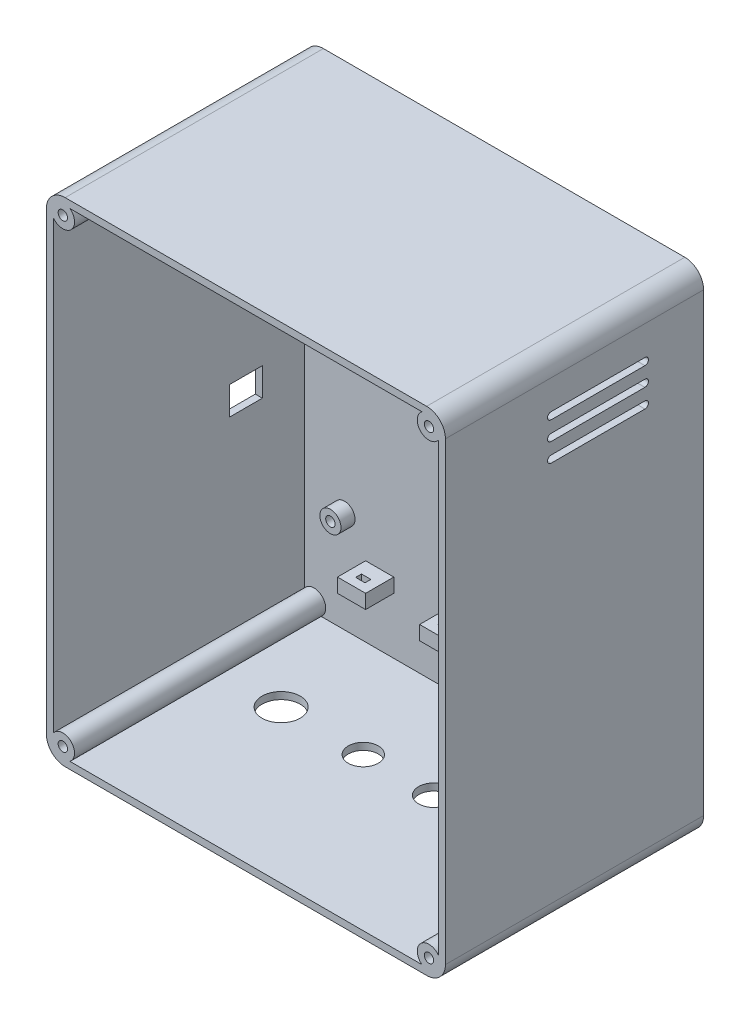
from build123d import *

# Parameters (mm, degrees)
BLOCK_DEPTH                    = 110
SHELL1_T                       = -3
SKETCH2_R                      = 5
CORNER_COLUMNS_DEPTH           = 110
SKETCH3_R                      = 2
FRONT_PANEL_INSERT_HOLES_DEPTH = 7
SKETCH4_R                      = 4.5
PLATE_BOSSES_DEPTH             = 6
SKETCH5_R                      = 2
PLATE_INSERT_HOLES_DEPTH       = 7
SKETCH6_R                      = 8.15
SKETCH6_R_2                    = 6.4
CABLE_GLAND_HOLES_DEPTH        = 4
SKETCH7_W                      = 12
SKETCH7_H                      = 6
CABLE_TIE_BARS_DEPTH           = 12
SKETCH8_W                      = 4
SKETCH8_H                      = 2.5
CABLE_TIE_SLOTS_DEPTH          = 6.02
SKETCH9_W                      = 14
SKETCH9_H                      = 12
USB_ACCESS_DEPTH               = 4
VENTS_LEFT_DEPTH               = 4
VENTS_START                    = -4
VENTS_RIGHT_DEPTH              = 4
SKETCH12_R                     = 4.75
KEYHOLE_HEADS_DEPTH            = 4
KEYHOLE_SLOTS_DEPTH            = 4


with BuildPart() as part:
    # Sketch1 → Block (new body)
    with BuildSketch(Plane.XY):
        with BuildLine():
            Line((-77, 0), (77, 0))
            ThreePointArc((77, 0), (82.656854249, 2.343145751), (85, 8))
            Line((85, 8), (85, 202))
            ThreePointArc((85, 202), (82.656854249, 207.656854249), (77, 210))
            Line((77, 210), (-77, 210))
            ThreePointArc((-77, 210), (-82.656854249, 207.656854249), (-85, 202))
            Line((-85, 202), (-85, 8))
            ThreePointArc((-85, 8), (-82.656854249, 2.343145751), (-77, 0))
        make_face()
    extrude(amount=BLOCK_DEPTH)

    # Shell1
    shell1_openings = [part.faces().sort_by_distance(p)[0] for p in [
        (0, 105, 110),
    ]]
    offset(amount=SHELL1_T, openings=shell1_openings, kind=Kind.INTERSECTION)

    # Sketch2 → Corner columns (add)
    with BuildSketch(Plane.XY):
        with Locations((-78, 7)):
            Circle(SKETCH2_R)
        with Locations((78, 7)):
            Circle(SKETCH2_R)
        with Locations((-78, 203)):
            Circle(SKETCH2_R)
        with Locations((78, 203)):
            Circle(SKETCH2_R)
    extrude(amount=CORNER_COLUMNS_DEPTH)

    # Sketch3 → Front panel insert holes (cut)
    with BuildSketch(Plane.XY.offset(110)):
        with Locations((-78, 7)):
            Circle(SKETCH3_R)
        with Locations((78, 7)):
            Circle(SKETCH3_R)
        with Locations((-78, 203)):
            Circle(SKETCH3_R)
        with Locations((78, 203)):
            Circle(SKETCH3_R)
    extrude(amount=-FRONT_PANEL_INSERT_HOLES_DEPTH, mode=Mode.SUBTRACT)

    # Sketch4 → Plate bosses (add)
    with BuildSketch(Plane.XY.offset(3)):
        with Locations((-65, 46)):
            Circle(SKETCH4_R)
        with Locations((65, 46)):
            Circle(SKETCH4_R)
        with Locations((-65, 190)):
            Circle(SKETCH4_R)
        with Locations((65, 190)):
            Circle(SKETCH4_R)
    extrude(amount=PLATE_BOSSES_DEPTH)

    # Sketch5 → Plate insert holes (cut)
    with BuildSketch(Plane.XY.offset(9)):
        with Locations((-65, 46)):
            Circle(SKETCH5_R)
        with Locations((65, 46)):
            Circle(SKETCH5_R)
        with Locations((-65, 190)):
            Circle(SKETCH5_R)
        with Locations((65, 190)):
            Circle(SKETCH5_R)
    extrude(amount=-PLATE_INSERT_HOLES_DEPTH, mode=Mode.SUBTRACT)

    # Sketch6 → Cable gland holes (cut)
    with BuildSketch(Plane(origin=(0, 0, 0), x_dir=(1, 0, 0), z_dir=(0, 1, 0))):
        with Locations(Location((-50, -45, 0), (0, 0, 270))):
            Circle(SKETCH6_R)
        with Locations(Location((-15, -45, 0), (0, 0, 270))):
            Circle(SKETCH6_R_2)
        with Locations(Location((15, -45, 0), (0, 0, 270))):
            Circle(SKETCH6_R_2)
        with Locations(Location((50, -45, 0), (0, 0, 270))):
            Circle(SKETCH6_R_2)
    extrude(amount=CABLE_GLAND_HOLES_DEPTH, mode=Mode.SUBTRACT)

    # Sketch7 → Cable tie bars (add)
    with BuildSketch(Plane.XY.offset(3)):
        with Locations((-50, 30)):
            Rectangle(SKETCH7_W, SKETCH7_H)
        with Locations((-15, 30)):
            Rectangle(SKETCH7_W, SKETCH7_H)
        with Locations((15, 30)):
            Rectangle(SKETCH7_W, SKETCH7_H)
        with Locations((50, 30)):
            Rectangle(SKETCH7_W, SKETCH7_H)
    extrude(amount=CABLE_TIE_BARS_DEPTH)

    # Sketch8 → Cable tie slots (cut)
    with BuildSketch(Plane(origin=(0, 26.99, 0), x_dir=(1, 0, 0), z_dir=(0, 1, 0))):
        with Locations((-50, -10)):
            Rectangle(SKETCH8_W, SKETCH8_H)
        with Locations((-15, -10)):
            Rectangle(SKETCH8_W, SKETCH8_H)
        with Locations((15, -10)):
            Rectangle(SKETCH8_W, SKETCH8_H)
        with Locations((50, -10)):
            Rectangle(SKETCH8_W, SKETCH8_H)
    extrude(amount=CABLE_TIE_SLOTS_DEPTH, mode=Mode.SUBTRACT)

    # Sketch9 → USB access (cut)
    with BuildSketch(Plane(origin=(-85, 0, 0), x_dir=(0, 0, -1), z_dir=(1, 0, 0))):
        with Locations((-28, 95)):
            Rectangle(SKETCH9_W, SKETCH9_H)
    extrude(amount=USB_ACCESS_DEPTH, mode=Mode.SUBTRACT)

    # Sketch10 → Vents left (cut)
    with BuildSketch(Plane(origin=(-85, 0, 0), x_dir=(0, 0, -1), z_dir=(1, 0, 0))):
        with BuildLine():
            Line((-25, 170.5), (-65, 170.5))
            ThreePointArc((-65, 170.5), (-66.5, 172), (-65, 173.5))
            Line((-65, 173.5), (-25, 173.5))
            ThreePointArc((-25, 173.5), (-23.5, 172), (-25, 170.5))
        make_face()
        with BuildLine():
            Line((-25, 178.5), (-65, 178.5))
            ThreePointArc((-65, 178.5), (-66.5, 180), (-65, 181.5))
            Line((-65, 181.5), (-25, 181.5))
            ThreePointArc((-25, 181.5), (-23.5, 180), (-25, 178.5))
        make_face()
        with BuildLine():
            Line((-25, 186.5), (-65, 186.5))
            ThreePointArc((-65, 186.5), (-66.5, 188), (-65, 189.5))
            Line((-65, 189.5), (-25, 189.5))
            ThreePointArc((-25, 189.5), (-23.5, 188), (-25, 186.5))
        make_face()
    extrude(amount=VENTS_LEFT_DEPTH, mode=Mode.SUBTRACT)

    # Sketch11 → Vents right (cut)
    with BuildSketch(Plane(origin=(85, 0, 0), x_dir=(0, 0, -1), z_dir=(1, 0, 0)).offset(VENTS_START)):
        with BuildLine():
            Line((-25, 170.5), (-65, 170.5))
            ThreePointArc((-65, 170.5), (-66.5, 172), (-65, 173.5))
            Line((-65, 173.5), (-25, 173.5))
            ThreePointArc((-25, 173.5), (-23.5, 172), (-25, 170.5))
        make_face()
        with BuildLine():
            Line((-25, 178.5), (-65, 178.5))
            ThreePointArc((-65, 178.5), (-66.5, 180), (-65, 181.5))
            Line((-65, 181.5), (-25, 181.5))
            ThreePointArc((-25, 181.5), (-23.5, 180), (-25, 178.5))
        make_face()
        with BuildLine():
            Line((-25, 186.5), (-65, 186.5))
            ThreePointArc((-65, 186.5), (-66.5, 188), (-65, 189.5))
            Line((-65, 189.5), (-25, 189.5))
            ThreePointArc((-25, 189.5), (-23.5, 188), (-25, 186.5))
        make_face()
    extrude(amount=VENTS_RIGHT_DEPTH, mode=Mode.SUBTRACT)

    # Sketch12 → Keyhole heads (cut)
    with BuildSketch(Plane.XY):
        with Locations((-45, 165)):
            Circle(SKETCH12_R)
        with Locations((45, 165)):
            Circle(SKETCH12_R)
    extrude(amount=KEYHOLE_HEADS_DEPTH, mode=Mode.SUBTRACT)

    # Sketch13 → Keyhole slots (cut)
    with BuildSketch(Plane.XY):
        with BuildLine():
            Line((-47.15, 165), (-47.15, 176))
            ThreePointArc((-47.15, 176), (-45, 178.15), (-42.85, 176))
            Line((-42.85, 176), (-42.85, 165))
            ThreePointArc((-42.85, 165), (-45, 162.85), (-47.15, 165))
        make_face()
        with BuildLine():
            Line((42.85, 165), (42.85, 176))
            ThreePointArc((42.85, 176), (45, 178.15), (47.15, 176))
            Line((47.15, 176), (47.15, 165))
            ThreePointArc((47.15, 165), (45, 162.85), (42.85, 165))
        make_face()
    extrude(amount=KEYHOLE_SLOTS_DEPTH, mode=Mode.SUBTRACT)


solid = part.part
